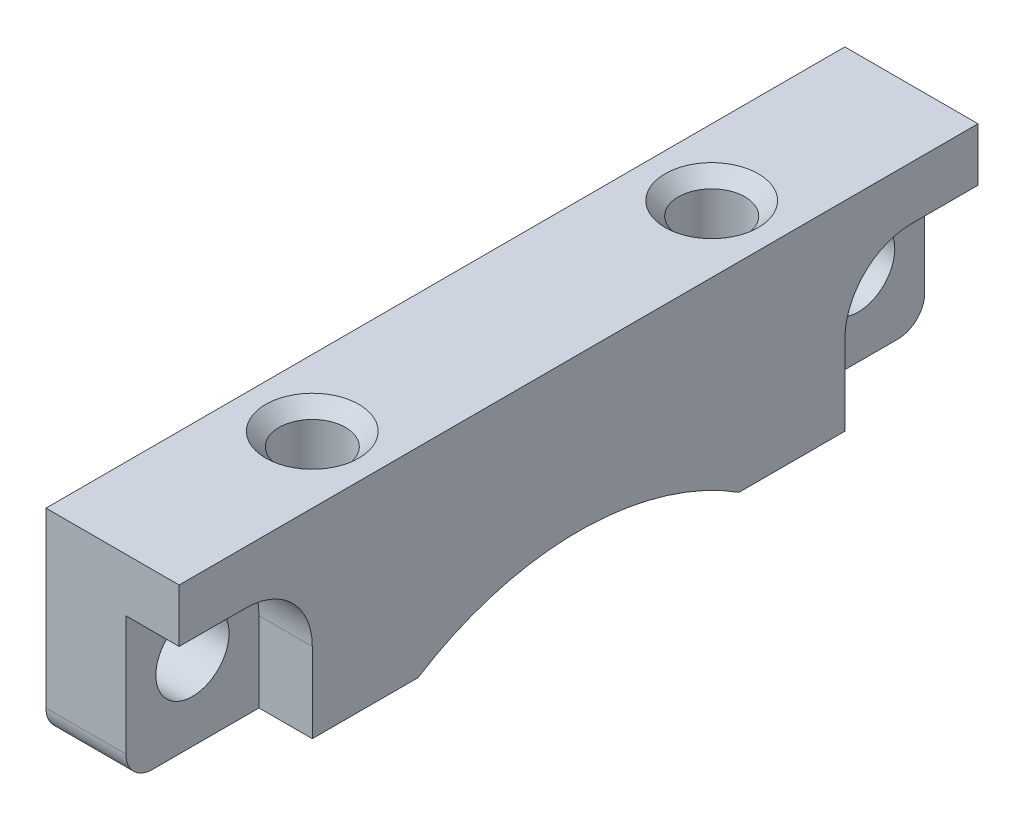
from build123d import *

# Parameters (mm, degrees)
SKETCH_7_W                  = 60
SKETCH_7_H                  = 64
EXTRUDE_1_DEPTH             = 10
SKETCH_12_R                 = 22.5
CUT_EXTRUDE_6_DEPTH         = 10
SKETCH_11_W                 = 69.759203198
SKETCH_11_H                 = 53.938344997
CUT_EXTRUDE_5_DEPTH         = 10
HOLE_WIZARD_M51_D           = 5.5
HOLE_WIZARD_M61_D           = 5
HOLE_WIZARD_M61_CSINK_D     = 7
HOLE_WIZARD_M61_CSINK_ANGLE = 90
CUT_EXTRUDE_7_DEPTH         = 4
FILLET_1_R                  = 2


with BuildPart() as part:
    # Эскиз7 → Бобышка-Вытянуть1 (new body)
    with BuildSketch(Plane(origin=(0, 0, 0), x_dir=(0, 0, -1), z_dir=(1, 0, 0))):
        with Locations((0, 2)):
            Rectangle(SKETCH_7_W, SKETCH_7_H)
    extrude(amount=EXTRUDE_1_DEPTH)

    # Эскиз12 → Вырез-Вытянуть6 (cut)
    with BuildSketch(Plane.ZY):
        Circle(SKETCH_12_R)
    extrude(amount=-CUT_EXTRUDE_6_DEPTH, mode=Mode.SUBTRACT)

    # Эскиз11 → Вырез-Вытянуть5 (cut)
    with BuildSketch(Plane(origin=(10, 0, 0), x_dir=(0, 0, -1), z_dir=(1, 0, 0))):
        with Locations((0.089558527, -7.969172499)):
            Rectangle(SKETCH_11_W, SKETCH_11_H)
    extrude(amount=-CUT_EXTRUDE_5_DEPTH, mode=Mode.SUBTRACT)

    # Сверло под метчик  спиральное M51 (through all)
    with Locations(Plane(origin=(10, 0, 0), x_dir=(0, 0, -1), z_dir=(1, 0, 0))):
        with Locations((-25, 25), (25, 25)):
            Hole(HOLE_WIZARD_M51_D / 2)

    # Отверстие обработанное метчиком M61 (through all)
    with Locations(Plane(origin=(0, 34, 0), x_dir=(1, 0, 0), z_dir=(0, 1, 0))):
        with Locations((5, 15), (5, -15)):
            CounterSinkHole(HOLE_WIZARD_M61_D / 2, HOLE_WIZARD_M61_CSINK_D / 2, counter_sink_angle=HOLE_WIZARD_M61_CSINK_ANGLE)

    # Эскиз16 → Вырез-Вытянуть7 (cut)
    with BuildSketch(Plane(origin=(10, 0, 0), x_dir=(0, 0, -1), z_dir=(1, 0, 0))):
        with BuildLine():
            Line((-25, 30), (-30, 30))
            Line((-30, 30), (-30, 19))
            Line((-30, 19), (-20, 19))
            Line((-20, 19), (-20, 25))
            ThreePointArc((-20, 25), (-21.464466094, 28.535533906), (-25, 30))
        make_face()
        with BuildLine():
            Line((20, 25), (20, 19))
            Line((20, 19), (30, 19))
            Line((30, 19), (30, 30))
            Line((30, 30), (25, 30))
            ThreePointArc((25, 30), (21.464466094, 28.535533906), (20, 25))
        make_face()
    extrude(amount=-CUT_EXTRUDE_7_DEPTH, mode=Mode.SUBTRACT)

    # Скругление1
    fillet_1_edges = [part.edges().sort_by_distance(p)[0] for p in [
        (3, 19, 30),
        (3, 19, -30),
    ]]
    fillet(fillet_1_edges, radius=FILLET_1_R)


solid = part.part
